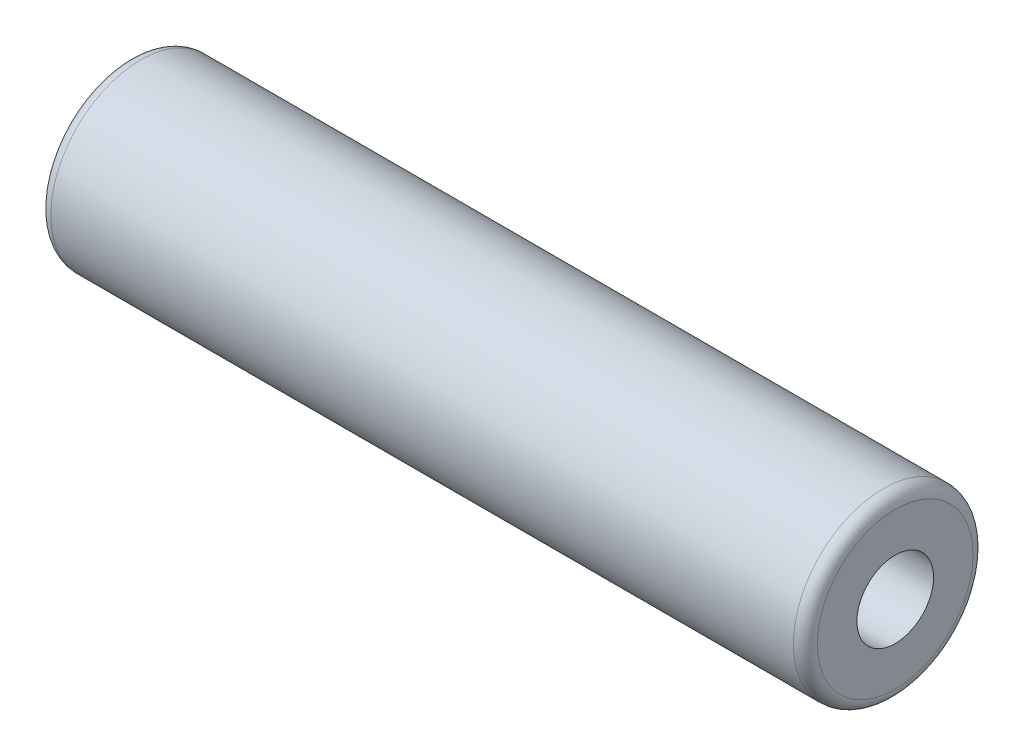
from build123d import *

# Parameters (mm, degrees)
SKETCH1_R           = 4.7625
BOSS_EXTRUDE1_DEPTH = 20.32
SKETCH3_R           = 2.032
CUT_EXTRUDE1_DEPTH  = 42.194325004
FILLET1_R           = 0.635


with BuildPart() as part:
    # Sketch1 → Boss-Extrude1 (new, symmetric)
    with BuildSketch(Plane(origin=(0, 0, 0), x_dir=(0, 0, -1), z_dir=(1, 0, 0))):
        Circle(SKETCH1_R)
    extrude(amount=BOSS_EXTRUDE1_DEPTH, both=True)

    # Sketch3 → Cut-Extrude1 (cut, through all)
    with BuildSketch(Plane(origin=(20.32, 0, 0), x_dir=(0, 0, -1), z_dir=(1, 0, 0))):
        Circle(SKETCH3_R)
    extrude(amount=-CUT_EXTRUDE1_DEPTH, mode=Mode.SUBTRACT)

    # Fillet1
    fillet1_edges = [part.edges().sort_by_distance(p)[0] for p in [
        (-20.32, 0, 4.7625),
        (20.32, 0, 4.7625),
    ]]
    fillet(fillet1_edges, radius=FILLET1_R)


solid = part.part
